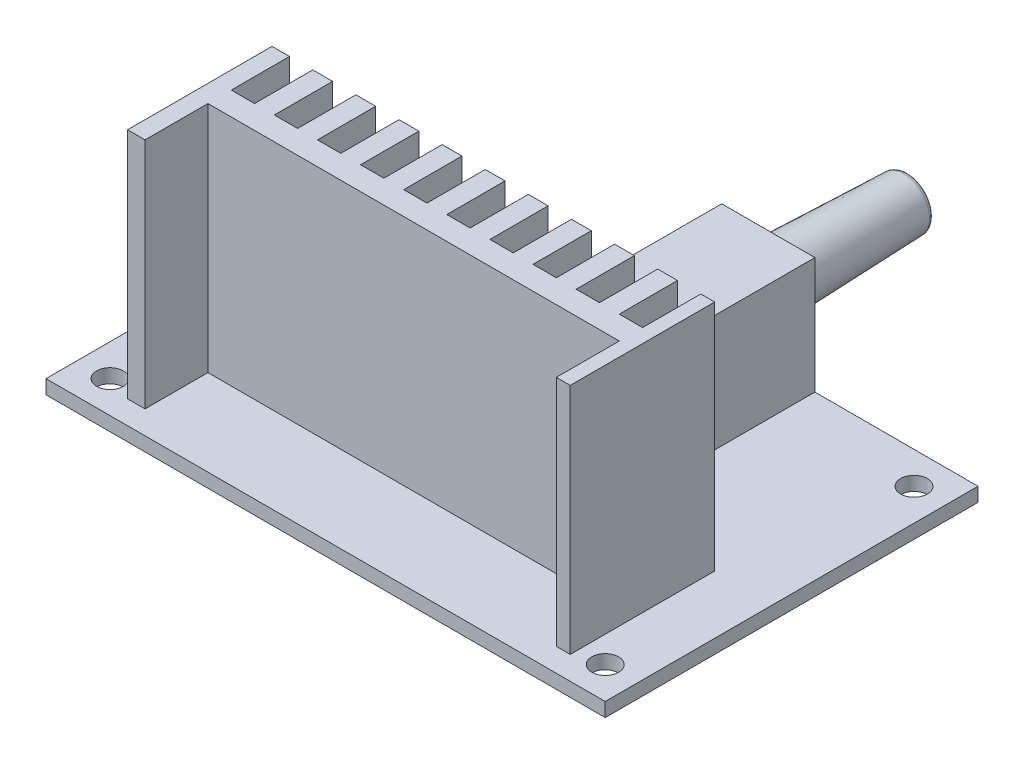
from build123d import *

# Parameters (mm, degrees)
SKETCH1_W           = 60.96
SKETCH1_H           = 40.64
BOSS_EXTRUDE1_DEPTH = 1.524
BOSS_EXTRUDE2_DEPTH = 25.4
SKETCH3_R           = 1.4605
CUT_EXTRUDE1_DEPTH  = 45.576819088
SKETCH4_W           = 10.16
SKETCH4_H           = 12.7
BOSS_EXTRUDE3_DEPTH = 12.7
SKETCH5_R           = 3.3401
BOSS_EXTRUDE4_DEPTH = 15.24
BOSS_EXTRUDE4_TAPER = 2
FILLET1_R           = 0.5


with BuildPart() as part:
    # Sketch1 → Boss-Extrude1 (new body)
    with BuildSketch(Plane(origin=(0, 0, 0), x_dir=(1, 0, 0), z_dir=(0, 1, 0))):
        Rectangle(SKETCH1_W, SKETCH1_H)
    extrude(amount=BOSS_EXTRUDE1_DEPTH)

    # Sketch2 → Boss-Extrude2 (add)
    with BuildSketch(Plane(origin=(0, 1.524, 0), x_dir=(1, 0, 0), z_dir=(0, 1, 0))):
        Polygon((-14.985, -2.032), (-14.985, -8.382), (-17.525, -8.382), (-17.525, -2.032), (-19.685, -2.032), (-19.685, -8.382), (-22.225, -8.382), (-22.225, -2.032), (-24.13, -2.032), (-24.13, -17.78), (-22.225, -17.78), (-22.225, -10.922), (22.615, -10.922), (22.615, -17.78), (24.13, -17.78), (24.13, -2.032), (22.615, -2.032), (22.615, -8.382), (20.075, -8.382), (20.075, -2.032), (17.915, -2.032), (17.915, -8.382), (15.375, -8.382), (15.375, -2.032), (13.215, -2.032), (13.215, -8.382), (10.675, -8.382), (10.675, -2.032), (8.515, -2.032), (8.515, -8.382), (5.975, -8.382), (5.975, -2.032), (3.815, -2.032), (3.815, -8.382), (1.275, -8.382), (1.275, -2.032), (-0.885, -2.032), (-0.885, -8.382), (-3.425, -8.382), (-3.425, -2.032), (-5.585, -2.032), (-5.585, -8.382), (-8.125, -8.382), (-8.125, -2.032), (-10.285, -2.032), (-10.285, -8.382), (-12.825, -8.382), (-12.825, -2.032), align=None)
    extrude(amount=BOSS_EXTRUDE2_DEPTH)

    # Sketch3 → Cut-Extrude1 (cut, through all)
    with BuildSketch(Plane(origin=(0, 1.524, 0), x_dir=(1, 0, 0), z_dir=(0, 1, 0))):
        with Locations(Location((-26.994541112, 16.83, 0), (0, 0, 270))):
            Circle(SKETCH3_R)
        with Locations(Location((26.994541112, 16.83, 0), (0, 0, 270))):
            Circle(SKETCH3_R)
        with Locations(Location((26.994541112, -16.83, 0), (0, 0, 270))):
            Circle(SKETCH3_R)
        with Locations(Location((-26.994541112, -16.83, 0), (0, 0, 270))):
            Circle(SKETCH3_R)
    extrude(amount=-CUT_EXTRUDE1_DEPTH, mode=Mode.SUBTRACT)


with BuildPart() as body_2:
    # Sketch4 → Boss-Extrude3 (new body)
    with BuildSketch(Plane(origin=(0, 1.524, 0), x_dir=(1, 0, 0), z_dir=(0, 1, 0))):
        with Locations((7.62, 13.97)):
            Rectangle(SKETCH4_W, SKETCH4_H)
    extrude(amount=BOSS_EXTRUDE3_DEPTH)


with BuildPart() as body_3:
    # Sketch5 → Boss-Extrude4 (new body)
    with BuildSketch(Plane(origin=(0, 0, -20.32), x_dir=(-1, 0, 0), z_dir=(0, 0, -1))):
        with Locations((-7.62, 9.398694036)):
            Circle(SKETCH5_R)
    extrude(amount=BOSS_EXTRUDE4_DEPTH, taper=BOSS_EXTRUDE4_TAPER)

    # Fillet1
    fillet1_edges = [body_3.edges().sort_by_distance(p)[0] for p in [
        (10.427907473, 9.398694036, -35.56),
    ]]
    fillet(fillet1_edges, radius=FILLET1_R)


solid = Compound([part.part, body_2.part, body_3.part])
